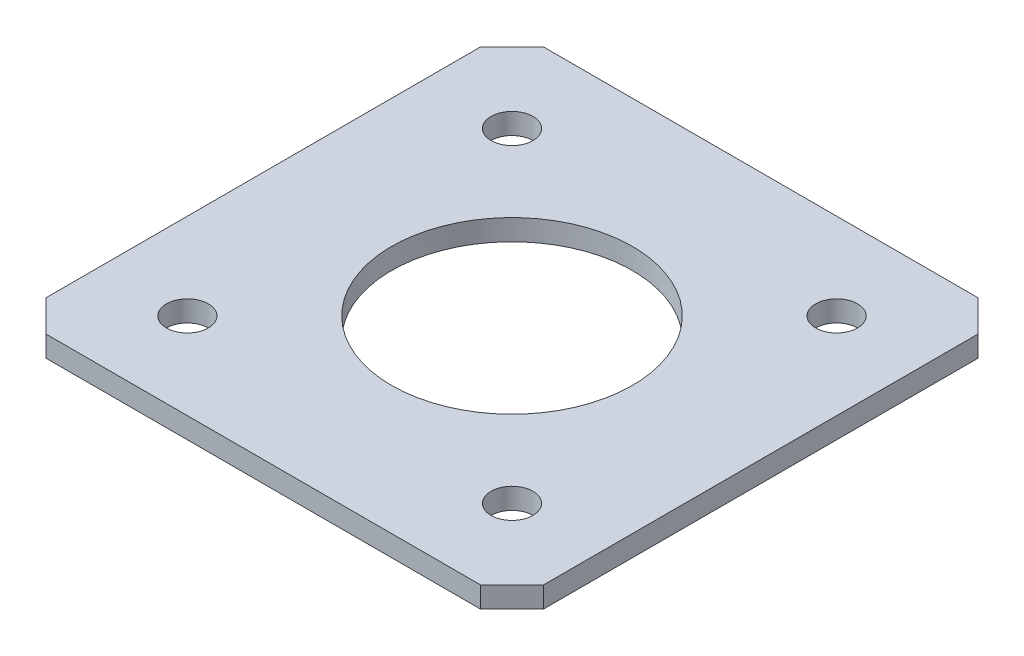
from build123d import *

# Parameters (mm, degrees)
SKETCH2_W           = 47.5
SKETCH2_H           = 47.5
SKETCH2_R           = 2
SKETCH2_R_2         = 11.5
BOSS_EXTRUDE1_DEPTH = 2
CHAMFER1_SIZE       = 3


with BuildPart() as part:
    # Sketch2 → Boss-Extrude1 (new body)
    with BuildSketch(Plane(origin=(0, 0, 0), x_dir=(1, 0, 0), z_dir=(0, 1, 0))):
        Rectangle(SKETCH2_W, SKETCH2_H)
        with Locations(Location((-15.5, 15.5, 0), (0, 0, 270))):
            Circle(SKETCH2_R, mode=Mode.SUBTRACT)
        with Locations(Location((15.5, 15.5, 0), (0, 0, 270))):
            Circle(SKETCH2_R, mode=Mode.SUBTRACT)
        with Locations(Location((15.5, -15.5, 0), (0, 0, 270))):
            Circle(SKETCH2_R, mode=Mode.SUBTRACT)
        with Locations(Location((-15.5, -15.5, 0), (0, 0, 270))):
            Circle(SKETCH2_R, mode=Mode.SUBTRACT)
        with Locations(Location((0, 0, 0), (0, 0, 270))):
            Circle(SKETCH2_R_2, mode=Mode.SUBTRACT)
    extrude(amount=BOSS_EXTRUDE1_DEPTH)

    # Chamfer1
    chamfer1_edges = [part.edges().sort_by_distance(p)[0] for p in [
        (23.75, 1, 23.75),
        (-23.75, 1, 23.75),
        (-23.75, 1, -23.75),
        (23.75, 1, -23.75),
    ]]
    chamfer(chamfer1_edges, length=CHAMFER1_SIZE)


solid = part.part
